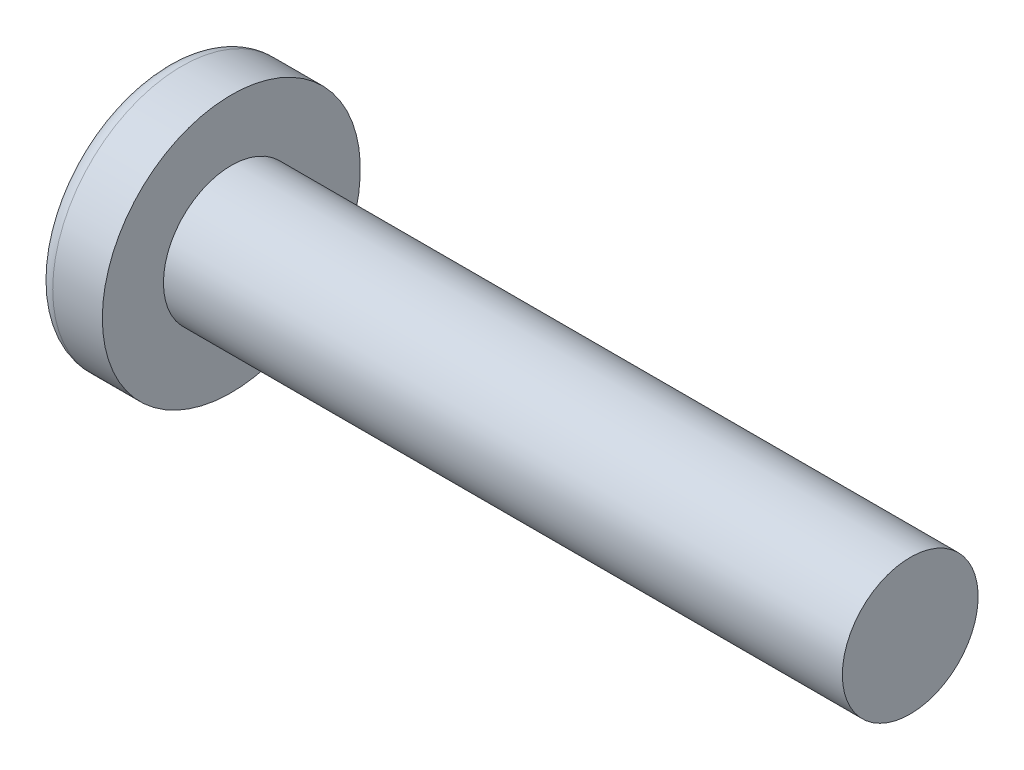
from build123d import *

# Parameters (mm, degrees)
CIRPATTERN1_COUNT = 2
CIRPATTERN1_ANGLE = 90


with BuildPart() as part:
    # BodySke → Base-Revolve (revolve)
    with BuildSketch(Plane.XY, mode=Mode.PRIVATE) as base_revolve_sk:
        with BuildLine():
            Line((3.7, 2.5), (3.7, 4.75))
            Line((3.7, 4.75), (1.873214546, 4.75))
            ThreePointArc((1.873214546, 4.75), (1.592049018, 4.680043343), (1.376448158, 4.486486486))
            ThreePointArc((1.376448158, 4.486486486), (0.351849415, 2.346442548), (0, 0))
            Line((0, 0), (28.7, 0))
            Line((28.7, 0), (28.7, 2.5))
            Line((28.7, 2.5), (3.7, 2.5))
        make_face()
    revolve(base_revolve_sk.sketch.rotate(Axis((-25.4, 0, 0), (1, 0, 0)), 90), axis=Axis((-25.4, 0, 0), (1, 0, 0)))

    # Sketch3 → Cut-Loft1 section 0
    with BuildSketch(Plane(origin=(0, 0, 0), x_dir=(0, 0, -1), z_dir=(1, 0, 0))):
        with BuildLine():
            Line((0.5, -2.45), (-0.5, -2.45))
            Line((-0.5, -2.45), (-0.5, 2.45))
            Line((-0.5, 2.45), (0.5, 2.45))
            Line((0.5, 2.45), (0.5, -2.45))
        make_face()
    # Sketch4 → Cut-Loft1 section 1
    with BuildSketch(Plane(origin=(2.95, 0, 0), x_dir=(0, 0, -1), z_dir=(1, 0, 0))):
        with BuildLine():
            Line((0.25, -0.25), (-0.25, -0.25))
            Line((-0.25, -0.25), (-0.25, 0.25))
            Line((-0.25, 0.25), (0.25, 0.25))
            Line((0.25, 0.25), (0.25, -0.25))
        make_face()
    cut_loft1 = loft(mode=Mode.SUBTRACT)

    # CirPattern1: Cut-Loft1 ×2 about axis
    cirpattern1_axis = Axis((0, 0, 0), (1, 0, 0))
    for i in range(1, CIRPATTERN1_COUNT):
        add(cut_loft1.rotate(cirpattern1_axis, i * CIRPATTERN1_ANGLE / (CIRPATTERN1_COUNT - 1)), mode=Mode.SUBTRACT)


solid = part.part
